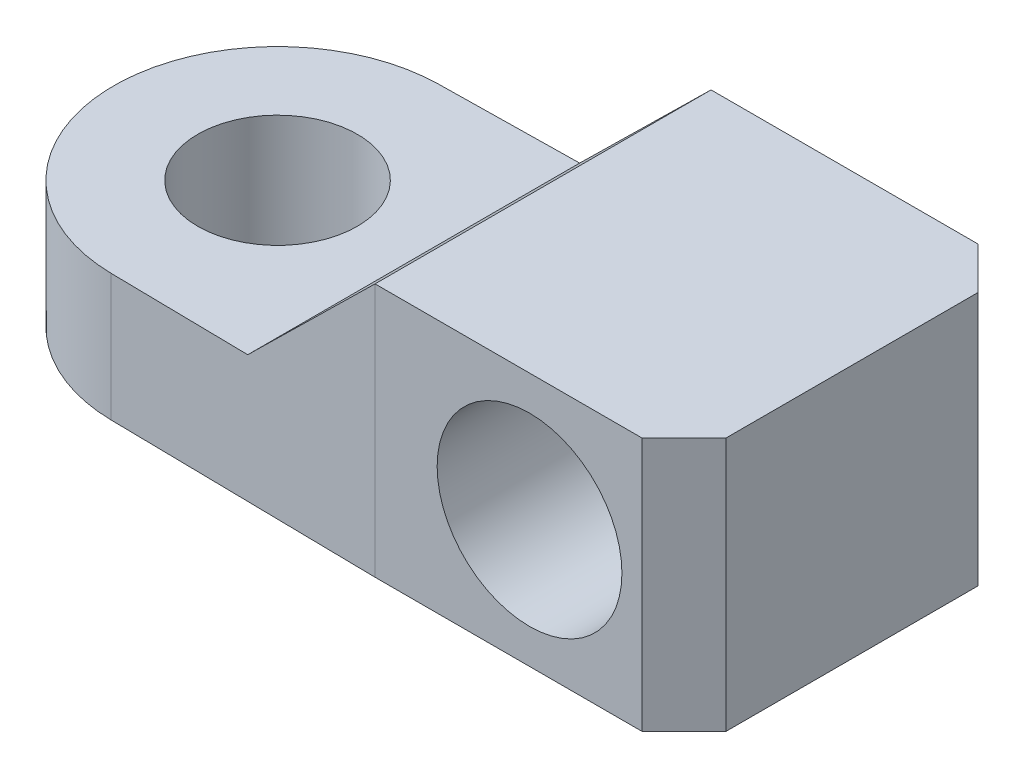
from build123d import *

# Parameters (mm, degrees)
SKETCH1_R               = 1.9
BOSS_EXTRUDE1_DEPTH     = 6.05
CUT_EXTRUDE1_DEPTH      = 19
CUT_EXTRUDE1_DEPTH_BACK = 21
SKETCH2_R               = 2.2
CHAMFER2_SIZE           = 1
CUT_EXTRUDE2_DEPTH      = 10
CUT_EXTRUDE2_DEPTH_BACK = 10


with BuildPart() as part:
    # Sketch1 → Boss-Extrude1 (new body)
    with BuildSketch(Plane(origin=(0, 0, 0), x_dir=(1, 0, 0), z_dir=(0, 1, 0))):
        with BuildLine():
            Line((-0.061383878, 3.899516896), (6.321978872, 4))
            Line((6.321978872, 4), (13.678021128, 4))
            Line((13.678021128, 4), (13.678021128, -4))
            Line((13.678021128, -4), (6.321978872, -4))
            Line((6.321978872, -4), (-0.061383878, -3.899516896))
            ThreePointArc((-0.061383878, -3.899516896), (-3.9, 0), (-0.061383878, 3.899516896))
        make_face()
        with Locations(Location((0, 0, 0), (0, 0, 270))):
            Circle(SKETCH1_R, mode=Mode.SUBTRACT)
    extrude(amount=BOSS_EXTRUDE1_DEPTH)

    # Sketch2 → Cut-Extrude1 (cut, two sides: drawn at the far end of the back side and taken through both)
    with BuildSketch(Plane.XY.offset(-CUT_EXTRUDE1_DEPTH_BACK)):
        with Locations(Location((10, 3.025, 0), (0, 0, 180))):
            Circle(SKETCH2_R)
    extrude(amount=CUT_EXTRUDE1_DEPTH + CUT_EXTRUDE1_DEPTH_BACK, mode=Mode.SUBTRACT)

    # Chamfer2
    chamfer2_edges = [part.edges().sort_by_distance(p)[0] for p in [
        (13.678021128, 3.025, -4),
        (13.678021128, 3.025, 4),
    ]]
    chamfer(chamfer2_edges, length=CHAMFER2_SIZE)

    # Sketch3 → Cut-Extrude2 (cut, two sides: drawn at the far end of the back side and taken through both)
    with BuildSketch(Plane.XY.offset(-CUT_EXTRUDE2_DEPTH_BACK)):
        Polygon((-3.9, 3.025), (3.241860159, 3.025), (6.321978872, 6.05), (-3.9, 6.05), align=None)
    extrude(amount=CUT_EXTRUDE2_DEPTH + CUT_EXTRUDE2_DEPTH_BACK, mode=Mode.SUBTRACT)


solid = part.part
